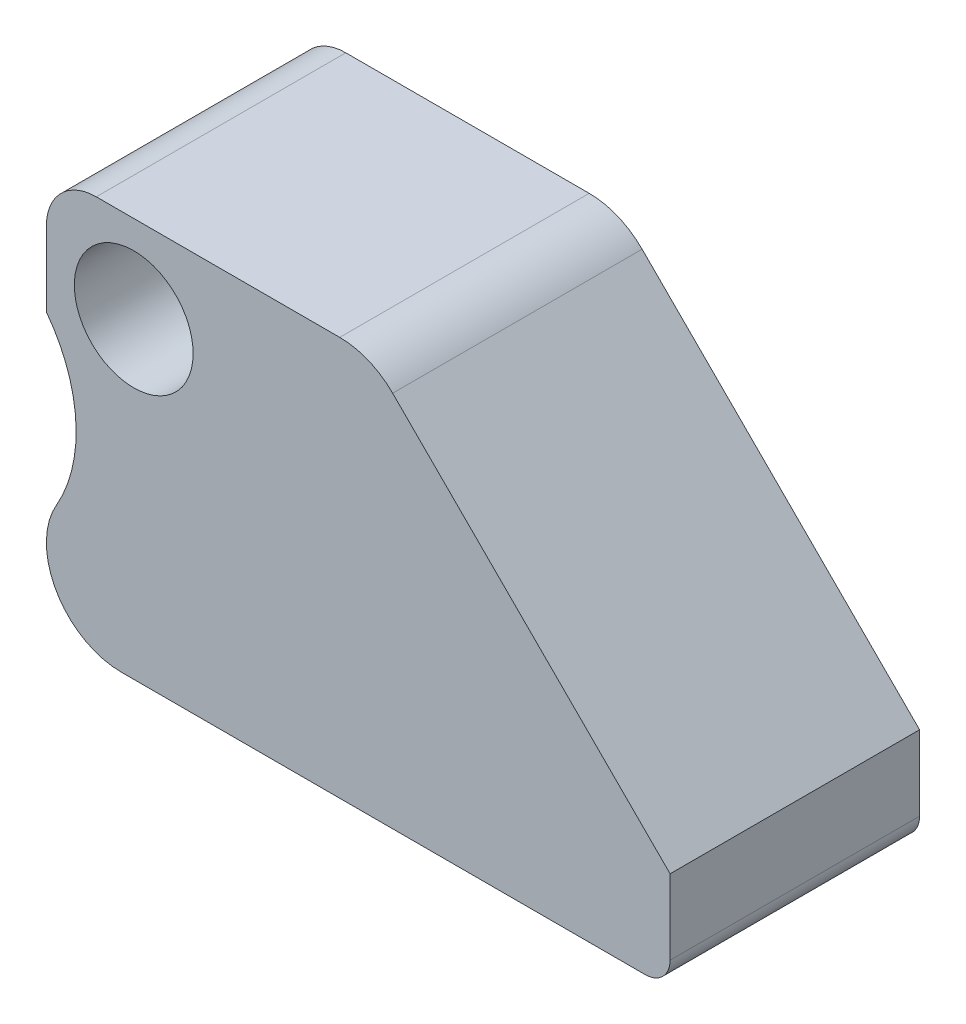
from build123d import *

# Parameters (mm, degrees)
SKETCH1_R           = 2.38125
BOSS_EXTRUDE1_DEPTH = 10
FILLET5_R           = 3
FILLET6_R           = 1
FILLET7_R           = 2


with BuildPart() as part:
    # Sketch1 → Boss-Extrude1 (new body)
    with BuildSketch(Plane.XY):
        with BuildLine():
            Line((12.5, -4), (0.5, 8))
            Line((0.5, 8), (-12.5, 8))
            Line((-12.5, 8), (-12.5, 3))
            ThreePointArc((-12.5, 3), (-11.31971292, -0.189443986), (-12.098076211, -3.5))
            ThreePointArc((-12.098076211, -3.5), (-12.397777479, -4.223542865), (-12.5, -5))
            ThreePointArc((-12.5, -5), (-11.621320344, -7.121320344), (-9.5, -8))
            Line((-9.5, -8), (12.5, -8))
            Line((12.5, -8), (12.5, -4))
        make_face()
        with Locations((-9, 4.5)):
            Circle(SKETCH1_R, mode=Mode.SUBTRACT)
    extrude(amount=BOSS_EXTRUDE1_DEPTH)

    # Fillet5
    fillet5_edges = [part.edges().sort_by_distance(p)[0] for p in [
        (0.5, 8, 5),
    ]]
    fillet(fillet5_edges, radius=FILLET5_R)

    # Fillet6
    fillet6_edges = [part.edges().sort_by_distance(p)[0] for p in [
        (12.5, -8, 5),
    ]]
    fillet(fillet6_edges, radius=FILLET6_R)

    # Fillet7
    fillet7_edges = [part.edges().sort_by_distance(p)[0] for p in [
        (-12.5, 8, 5),
    ]]
    fillet(fillet7_edges, radius=FILLET7_R)


solid = part.part
